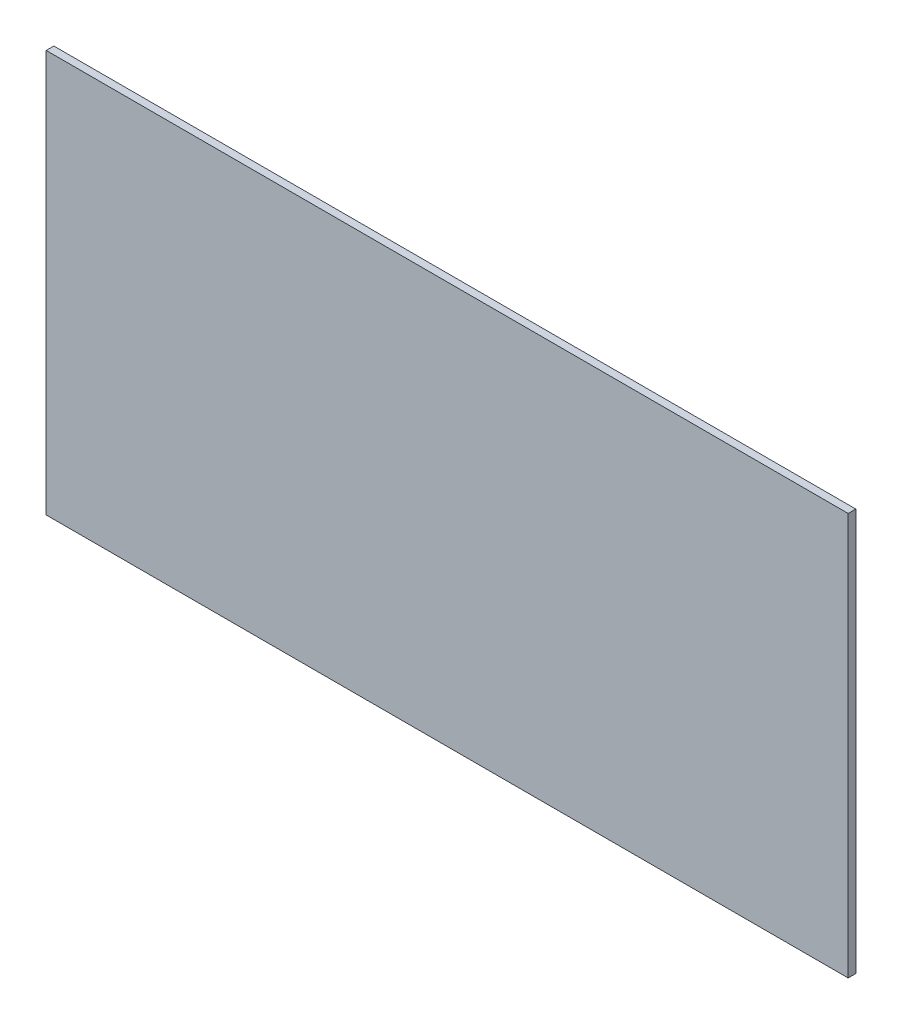
from build123d import *

# Parameters (mm, degrees)
SKETCH1_W           = 104.943697863
SKETCH1_H           = 52.643138972
BOSS_EXTRUDE1_DEPTH = 1


with BuildPart() as part:
    # Sketch1 → Boss-Extrude1 (new body)
    with BuildSketch(Plane.XY):
        with Locations((1.88419044, 7.536761762)):
            Rectangle(SKETCH1_W, SKETCH1_H)
    extrude(amount=BOSS_EXTRUDE1_DEPTH)


solid = part.part
